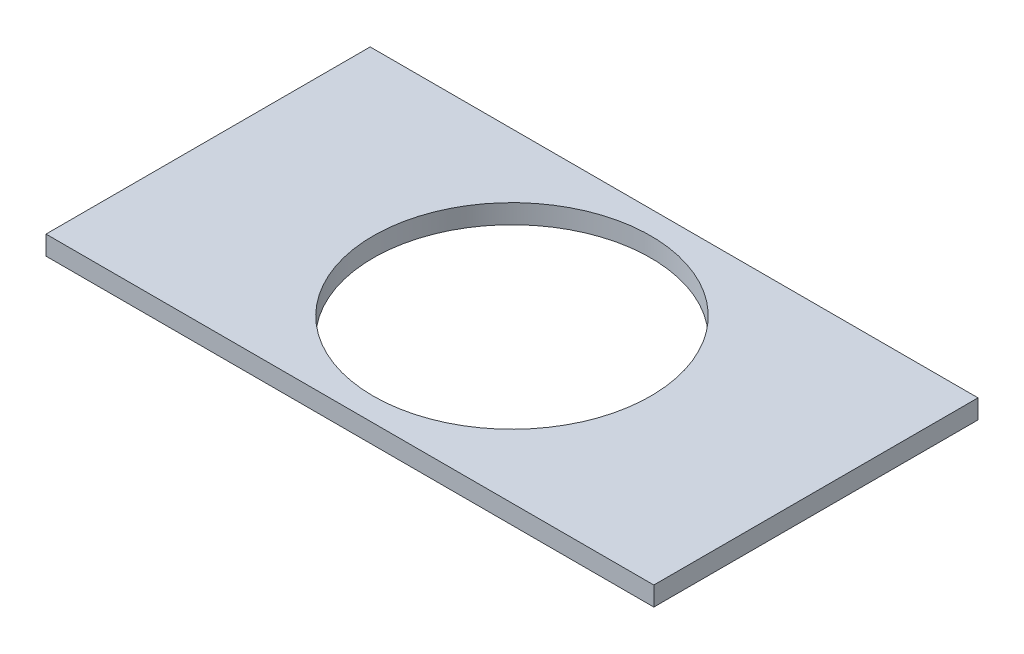
from build123d import *

# Parameters (mm, degrees)
SKETCH1_W               = 95.25
SKETCH1_H               = 50.8
BOSS_EXTRUDE1_DEPTH     = 3
CUT_EXTRUDE1_DEPTH      = 55.058307641
CUT_EXTRUDE1_DEPTH_BACK = 55.058307641
SKETCH2_R               = 21.75


with BuildPart() as part:
    # Sketch1 → Boss-Extrude1 (new body)
    with BuildSketch(Plane(origin=(0, 0, 0), x_dir=(1, 0, 0), z_dir=(0, 1, 0))):
        Rectangle(SKETCH1_W, SKETCH1_H)
    extrude(amount=BOSS_EXTRUDE1_DEPTH)

    # Sketch2 → Cut-Extrude1 (cut, two sides: drawn at the far end of the back side and taken through both)
    with BuildSketch(Plane(origin=(0, 3, 0), x_dir=(1, 0, 0), z_dir=(0, 1, 0)).offset(-CUT_EXTRUDE1_DEPTH_BACK)):
        with Locations(Location((0, 0, 0), (0, 0, 270))):
            Circle(SKETCH2_R)
    extrude(amount=CUT_EXTRUDE1_DEPTH + CUT_EXTRUDE1_DEPTH_BACK, mode=Mode.SUBTRACT)


solid = part.part
